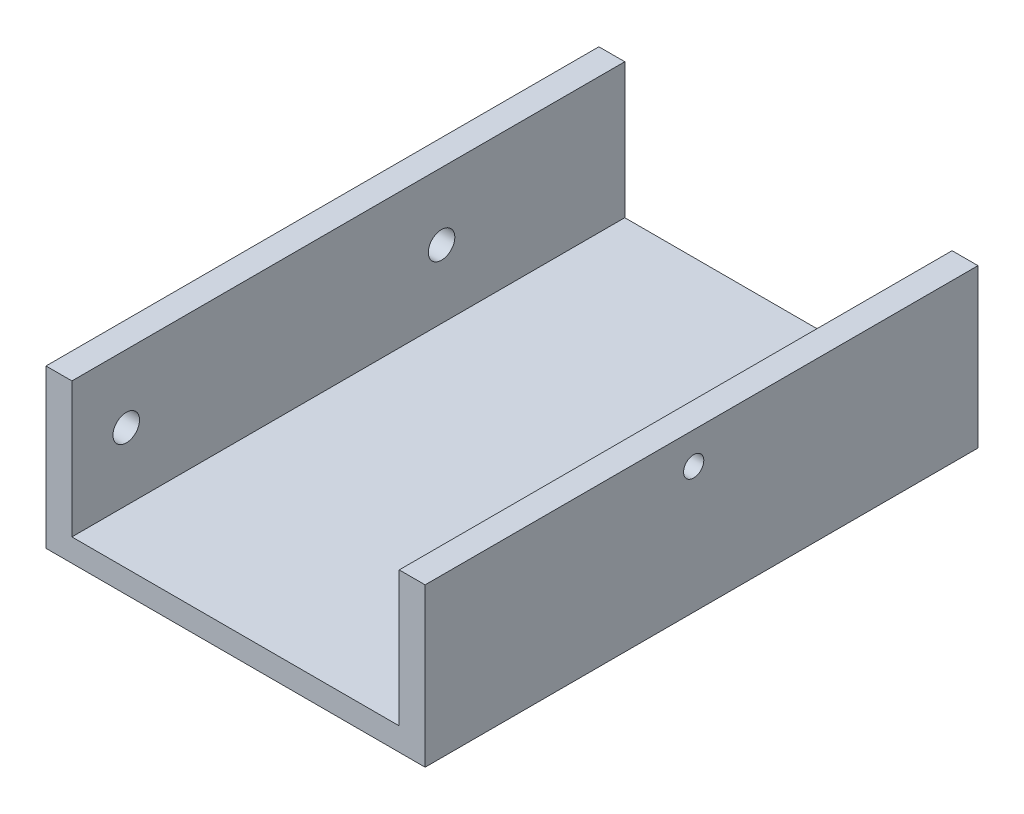
from build123d import *

# Parameters (mm, degrees)
BOSS_EXTRUDE3_DEPTH = 111.125
SKETCH4_R           = 2.667
CUT_EXTRUDE1_DEPTH  = 136.634929771
SKETCH5_R           = 2.667
CUT_EXTRUDE2_DEPTH  = 136.634929771
SKETCH6_R           = 2.032
CUT_EXTRUDE3_DEPTH  = 136.634929771


with BuildPart() as part:
    # Sketch2 → Boss-Extrude3 (new body)
    with BuildSketch(Plane.XY):
        Polygon((-38.1, 0), (38.1, 0), (38.1, 31.75), (32.893, 31.75), (32.893, 4.5974), (-32.893, 4.5974), (-32.893, 31.75), (-38.1, 31.75), align=None)
    extrude(amount=BOSS_EXTRUDE3_DEPTH)

    # Sketch4 → Cut-Extrude1 (cut, through all)
    with BuildSketch(Plane(origin=(-32.893, 0, 0), x_dir=(0, 0, -1), z_dir=(1, 0, 0))):
        with Locations((-36.83, 18.288)):
            Circle(SKETCH4_R)
    extrude(amount=-CUT_EXTRUDE1_DEPTH, mode=Mode.SUBTRACT)

    # Sketch5 → Cut-Extrude2 (cut, through all)
    with BuildSketch(Plane(origin=(-32.893, 0, 0), x_dir=(0, 0, -1), z_dir=(1, 0, 0))):
        with Locations((-100.203, 18.163390835)):
            Circle(SKETCH5_R)
    extrude(amount=-CUT_EXTRUDE2_DEPTH, mode=Mode.SUBTRACT)

    # Sketch6 → Cut-Extrude3 (cut, through all)
    with BuildSketch(Plane.ZY.offset(-32.893)):
        with Locations((57.15, 25.4)):
            Circle(SKETCH6_R)
    extrude(amount=-CUT_EXTRUDE3_DEPTH, mode=Mode.SUBTRACT)


solid = part.part
